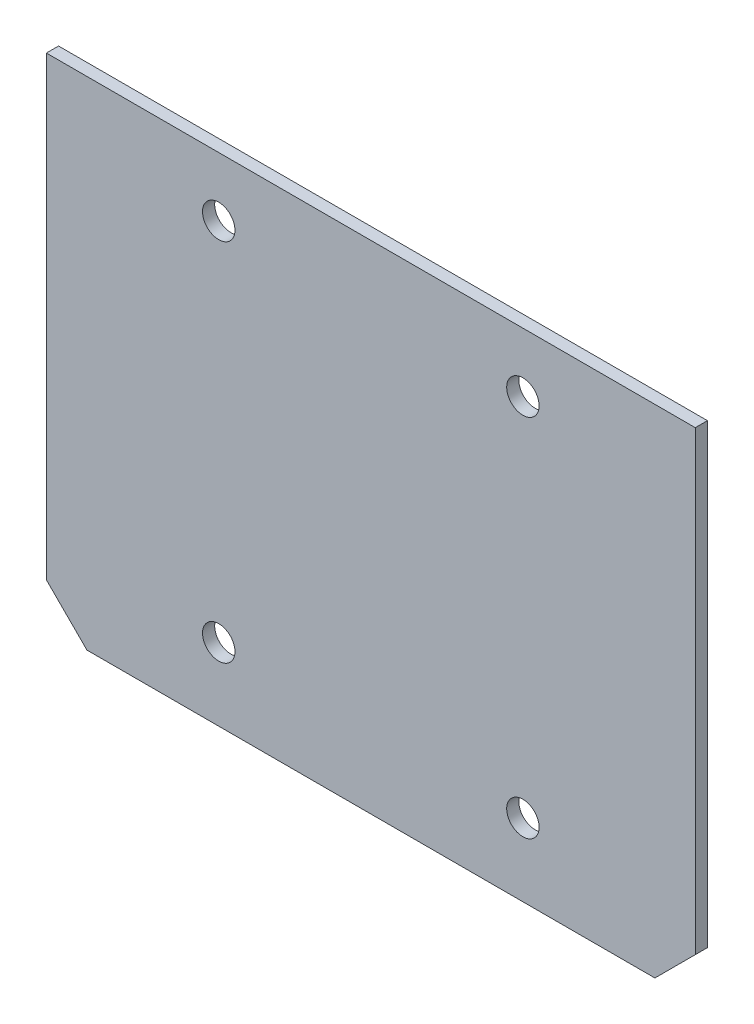
from build123d import *

# Parameters (mm, degrees)
SKETCH2_R           = 1.6
BOSS_EXTRUDE1_DEPTH = 1.2


with BuildPart() as part:
    # Sketch2 → Boss-Extrude1 (new body)
    with BuildSketch(Plane.XY.offset(9.801785136)):
        Polygon((-28, -37.413217807), (-32, -33.413217807), (-32, 11.586782193), (32, 11.586782193), (32.017485427, -33.413217807), (28.017485427, -37.413217807), align=None)
        with Locations((-15, 5.74456922)):
            Circle(SKETCH2_R, mode=Mode.SUBTRACT)
        with Locations((15, 5.74456922)):
            Circle(SKETCH2_R, mode=Mode.SUBTRACT)
        with Locations((-15, -30.25543078)):
            Circle(SKETCH2_R, mode=Mode.SUBTRACT)
        with Locations((15, -30.25543078)):
            Circle(SKETCH2_R, mode=Mode.SUBTRACT)
    extrude(amount=BOSS_EXTRUDE1_DEPTH)


solid = part.part
